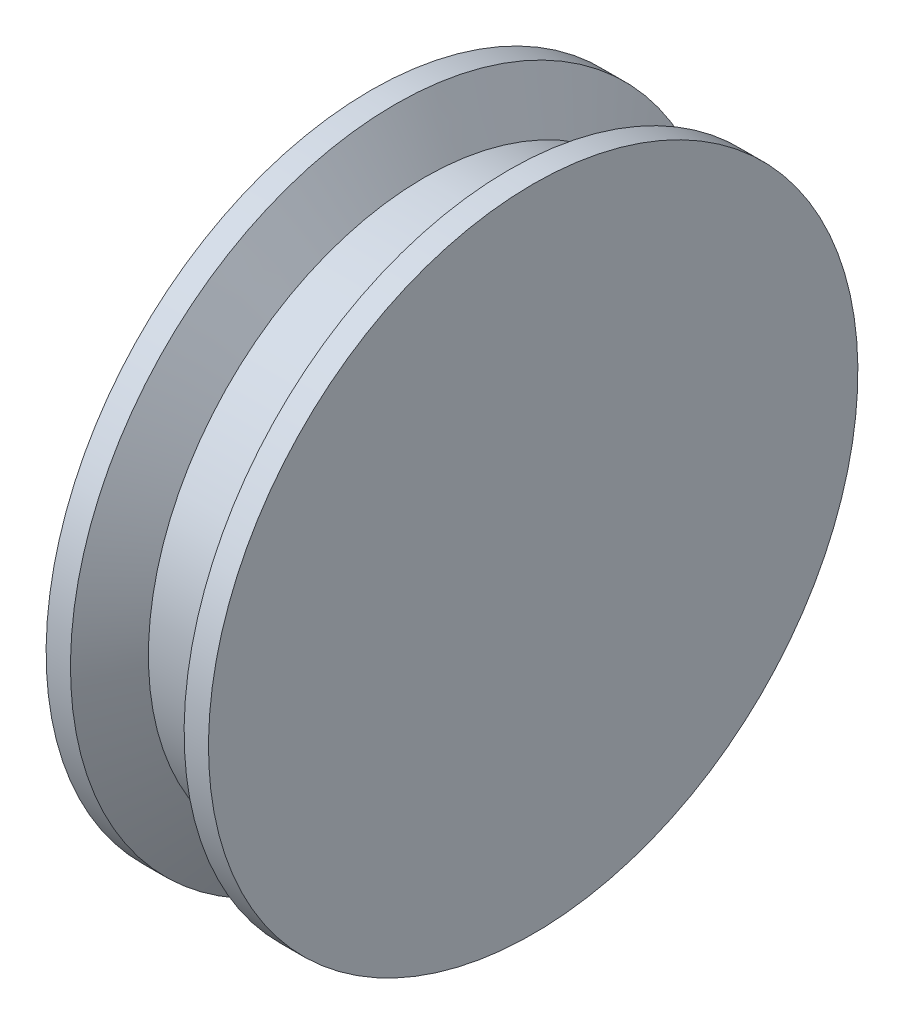
from build123d import *

# Parameters (mm, degrees)
SKETCH_4_R          = 10
CUT_EXTRUDE_1_DEPTH = 40
CUT_EXTRUDE_5_DEPTH = 14
CUT_EXTRUDE_6_DEPTH = 14


with BuildPart() as part:
    # 草图1 → 旋转1 (revolve)
    with BuildSketch(Plane.XY):
        Polygon((-131.316498316, -36.008306789), (-131.316498316, 163.991693211), (-116.316498316, 163.991693211), (-98.316498316, 133.991693211), (-64.316498316, 133.991693211), (-46.316498316, 163.991693211), (-31.316498316, 163.991693211), (-31.316498316, -36.008306789), align=None)
    revolve(axis=Axis((-31.316498316, -36.008306789, 0), (-1, 0, 0)))

    # 草图4 → 切除-拉伸1 (cut)
    with BuildSketch(Plane.ZY.offset(131.316498316)):
        with Locations((0, -36.008306789)):
            Circle(SKETCH_4_R)
    extrude(amount=-CUT_EXTRUDE_1_DEPTH, mode=Mode.SUBTRACT)

    # 草图9 → 切除-拉伸5 (cut)
    with BuildSketch(Plane.XY):
        with BuildLine():
            Line((-101.316498316, -31.008306789), (-121.316498316, -31.008306789))
            ThreePointArc((-121.316498316, -31.008306789), (-126.316498316, -36.008306789), (-121.316498316, -41.008306789))
            Line((-121.316498316, -41.008306789), (-101.316498316, -41.008306789))
            ThreePointArc((-101.316498316, -41.008306789), (-96.316498316, -36.008306789), (-101.316498316, -31.008306789))
        make_face()
    extrude(amount=-CUT_EXTRUDE_5_DEPTH, mode=Mode.SUBTRACT)

    # 草图9<4> → 切除-拉伸6 (cut)
    with BuildSketch(Plane.XY):
        with BuildLine():
            ThreePointArc((-121.316498316, -41.008306789), (-126.316498316, -36.008306789), (-121.316498316, -31.008306789))
            Line((-121.316498316, -31.008306789), (-131.316498316, -31.008306789))
            Line((-131.316498316, -31.008306789), (-131.316498316, -41.008306789))
            Line((-131.316498316, -41.008306789), (-121.316498316, -41.008306789))
        make_face()
    extrude(amount=-CUT_EXTRUDE_6_DEPTH, mode=Mode.SUBTRACT)


solid = part.part
